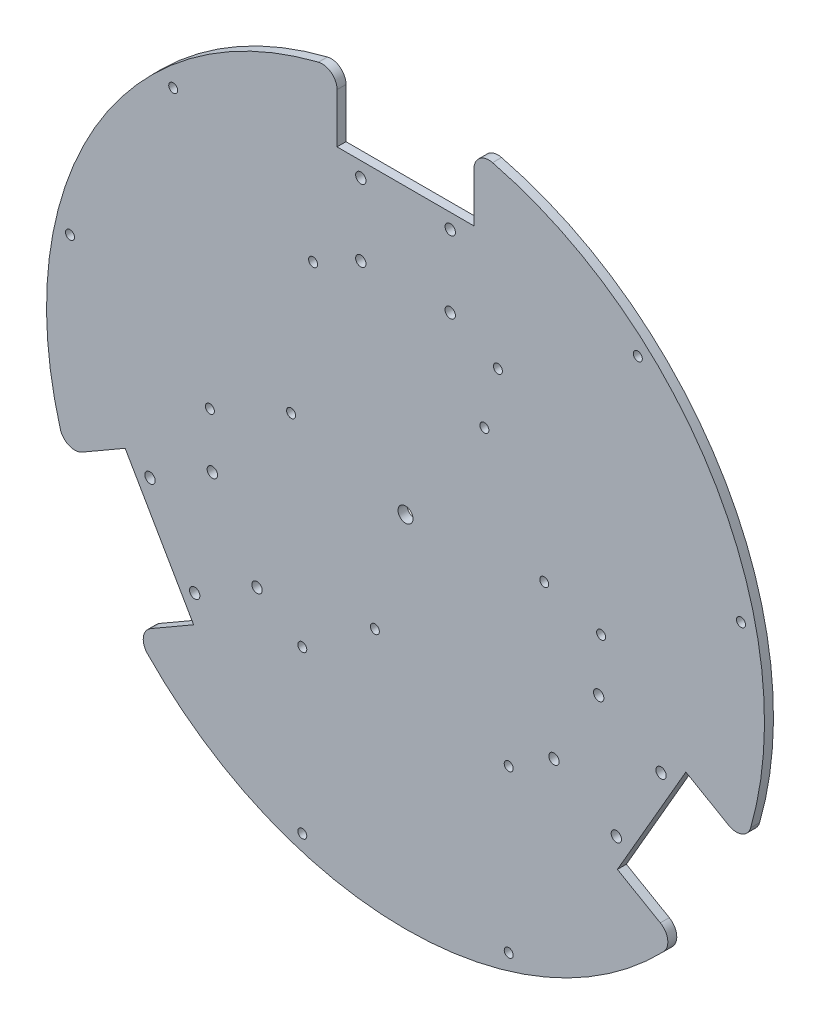
from build123d import *

# Parameters (mm, degrees)
SKETCH1_R           = 1.73
SKETCH1_R_2         = 2.5
BOSS_EXTRUDE2_DEPTH = 3
CUT_EXTRUDE1_DEPTH  = 10
SKETCH4_R           = 1.5
CUT_EXTRUDE2_DEPTH  = 153.155671711
BOSS_EXTRUDE3_DEPTH = 3
FILLET1_R           = 5
SKETCH6_R           = 1.5
CUT_EXTRUDE3_DEPTH  = 187.151001088


with BuildPart() as part:
    # Sketch1 → Boss-Extrude2 (new body)
    with BuildSketch(Plane.XY):
        Polygon((2.360735498, 103.328982943), (-74.24180488, -29.350508981), (-54.24180488, -63.991525133), (98.963275877, -63.991525133), (118.963275877, -29.350508981), (42.360735498, 103.328982943), align=None)
        with Locations((7.415735498, 93.328982943)):
            Circle(SKETCH1_R, mode=Mode.SUBTRACT)
        with Locations((37.305735498, 93.328982943)):
            Circle(SKETCH1_R, mode=Mode.SUBTRACT)
        with Locations((37.305735498, 69.268982943)):
            Circle(SKETCH1_R, mode=Mode.SUBTRACT)
        with Locations((7.415735498, 69.268982943)):
            Circle(SKETCH1_R, mode=Mode.SUBTRACT)
        with Locations((107.775521839, -28.728267397)):
            Circle(SKETCH1_R, mode=Mode.SUBTRACT)
        with Locations((86.938950624, -16.698267397)):
            Circle(SKETCH1_R, mode=Mode.SUBTRACT)
        with Locations((71.993950624, -42.583766716)):
            Circle(SKETCH1_R, mode=Mode.SUBTRACT)
        with Locations((92.830521839, -54.613766716)):
            Circle(SKETCH1_R, mode=Mode.SUBTRACT)
        with Locations((-42.217479627, -16.698267397)):
            Circle(SKETCH1_R, mode=Mode.SUBTRACT)
        with Locations((-27.272479627, -42.583766716)):
            Circle(SKETCH1_R, mode=Mode.SUBTRACT)
        with Locations((-63.054050843, -28.728267397)):
            Circle(SKETCH1_R, mode=Mode.SUBTRACT)
        with Locations((-48.109050843, -54.613766716)):
            Circle(SKETCH1_R, mode=Mode.SUBTRACT)
        with Locations((22.360735498, 3.328982943)):
            Circle(SKETCH1_R_2, mode=Mode.SUBTRACT)
    extrude(amount=BOSS_EXTRUDE2_DEPTH)

    # Sketch2 → Cut-Extrude1 (cut)
    with BuildSketch(Plane.XY.offset(3)):
        Polygon((-69.911677861, -26.850508981), (-71.355053534, -24.350508981), (-74.24180488, -29.350508981), align=None)
        Polygon((-48.468302188, -63.991525133), (-69.911677861, -26.850508981), (-74.24180488, -29.350508981), (-54.24180488, -63.991525133), align=None)
        Polygon((118.963275877, -29.350508981), (114.633148858, -26.850508981), (93.189773185, -63.991525133), (98.963275877, -63.991525133), align=None)
        Polygon((118.963275877, -29.350508981), (116.076524531, -24.350508981), (114.633148858, -26.850508981), align=None)
        Polygon((7.415735498, 98.328982943), (7.415735498, 103.328982943), (2.360735498, 103.328982943), (-0.526015848, 98.328982943), align=None)
        Polygon((42.360735498, 103.328982943), (7.415735498, 103.328982943), (7.415735498, 98.328982943), (45.247486844, 98.328982943), align=None)
    extrude(amount=-CUT_EXTRUDE1_DEPTH, mode=Mode.SUBTRACT)

    # Sketch4 → Cut-Extrude2 (cut, through all)
    with BuildSketch(Plane.XY.offset(3)):
        with Locations((12.112024192, -34.919728363)):
            Circle(SKETCH4_R)
        with Locations((68.733802457, 7.008474867)):
            Circle(SKETCH4_R)
        with Locations((48.733802457, 41.649491019)):
            Circle(SKETCH4_R)
        with Locations((-15.887975808, 13.577694249)):
            Circle(SKETCH4_R)
    extrude(amount=-CUT_EXTRUDE2_DEPTH, mode=Mode.SUBTRACT)

    # Sketch5 → Boss-Extrude3 (add)
    with BuildSketch(Plane.XY.offset(3)):
        with BuildLine():
            Line((45.247486844, 121.128982943), (45.247486844, 98.328982943))
            Line((45.247486844, 98.328982943), (116.076524531, -24.350508981))
            Line((116.076524531, -24.350508981), (135.821903737, -35.750508981))
            ThreePointArc((135.821903737, -35.750508981), (140.716740282, -16.482617667), (142.363416248, 3.328982943))
            ThreePointArc((142.363416248, 3.328982943), (114.954242026, 79.664334753), (45.247486844, 121.128982943))
        make_face()
        with BuildLine():
            Line((-71.355053534, -24.350508981), (-0.526015848, 98.328982943))
            Line((-0.526015848, 98.328982943), (-0.526015848, 121.128982943))
            ThreePointArc((-0.526015848, 121.128982943), (-81.564634554, 63.330323318), (-91.100432741, -35.750508981))
            Line((-91.100432741, -35.750508981), (-71.355053534, -24.350508981))
        make_face()
        with BuildLine():
            Line((93.189773185, -63.991525133), (-48.468302188, -63.991525133))
            Line((-48.468302188, -63.991525133), (-68.213681395, -75.391525133))
            ThreePointArc((-68.213681395, -75.391525133), (22.360735498, -116.673697807), (112.935152391, -75.391525133))
            Line((112.935152391, -75.391525133), (93.189773185, -63.991525133))
        make_face()
    extrude(amount=-BOSS_EXTRUDE3_DEPTH)

    # Fillet1
    fillet1_edges = [part.edges().sort_by_distance(p)[0] for p in [
        (135.821903737, -35.750508981, 1.5),
        (45.247486844, 121.128982943, 1.5),
        (-0.526015848, 121.128982943, 1.5),
        (-91.100432741, -35.750508981, 1.5),
        (-68.213681395, -75.391525133, 1.5),
        (112.935152391, -75.391525133, 1.5),
    ]]
    fillet(fillet1_edges, radius=FILLET1_R)

    # Sketch6 → Cut-Extrude3 (cut, through all)
    with BuildSketch(Plane(origin=(0, 0, 0), x_dir=(-1, 0, 0), z_dir=(0, 0, -1))):
        with BuildLine():
            ThreePointArc((91.295141666, 28.245040241), (90.545141666, 29.544078346), (89.045141666, 29.544078346))
            Line((89.045141666, 29.544078346), (89.795141666, 28.245040241))
            Line((89.795141666, 28.245040241), (88.49610356, 27.495040241))
            ThreePointArc((88.49610356, 27.495040241), (90.183370233, 26.796151501), (91.295141666, 28.245040241))
        make_face()
        with BuildLine():
            Line((89.795141666, 28.245040241), (89.045141666, 29.544078346))
            ThreePointArc((89.045141666, 29.544078346), (88.346252926, 28.633268808), (88.49610356, 27.495040241))
            Line((88.49610356, 27.495040241), (89.795141666, 28.245040241))
        make_face()
        with BuildLine():
            ThreePointArc((91.295141666, 28.245040241), (90.545141666, 29.544078346), (89.045141666, 29.544078346))
            Line((89.045141666, 29.544078346), (89.795141666, 28.245040241))
            Line((89.795141666, 28.245040241), (88.49610356, 27.495040241))
            ThreePointArc((88.49610356, 27.495040241), (90.183370233, 26.796151501), (91.295141666, 28.245040241))
        make_face()
        with BuildLine():
            Line((89.795141666, 28.245040241), (89.045141666, 29.544078346))
            ThreePointArc((89.045141666, 29.544078346), (88.346252926, 28.633268808), (88.49610356, 27.495040241))
            Line((88.49610356, 27.495040241), (89.795141666, 28.245040241))
        make_face()
        with Locations((43.029769861, 1.245040241)):
            Circle(SKETCH6_R)
        with Locations((8.529769861, 61.000793102)):
            Circle(SKETCH6_R)
        with Locations((55.295141666, 88.000793102)):
            Circle(SKETCH6_R)
        with Locations((-100.016612662, 88.000793102)):
            Circle(SKETCH6_R)
        with Locations((-53.251240857, 61.000793102)):
            Circle(SKETCH6_R)
        with Locations((-134.516612662, 28.245040241)):
            Circle(SKETCH6_R)
        with Locations((-87.751240857, 1.245040241)):
            Circle(SKETCH6_R)
        with Locations((-56.860735498, -52.258884513)):
            Circle(SKETCH6_R)
        with Locations((12.139264502, -52.258884513)):
            Circle(SKETCH6_R)
        with Locations((-56.860735498, -106.258884513)):
            Circle(SKETCH6_R)
        with Locations((12.139264502, -106.258884513)):
            Circle(SKETCH6_R)
    extrude(amount=-CUT_EXTRUDE3_DEPTH, mode=Mode.SUBTRACT)


solid = part.part
